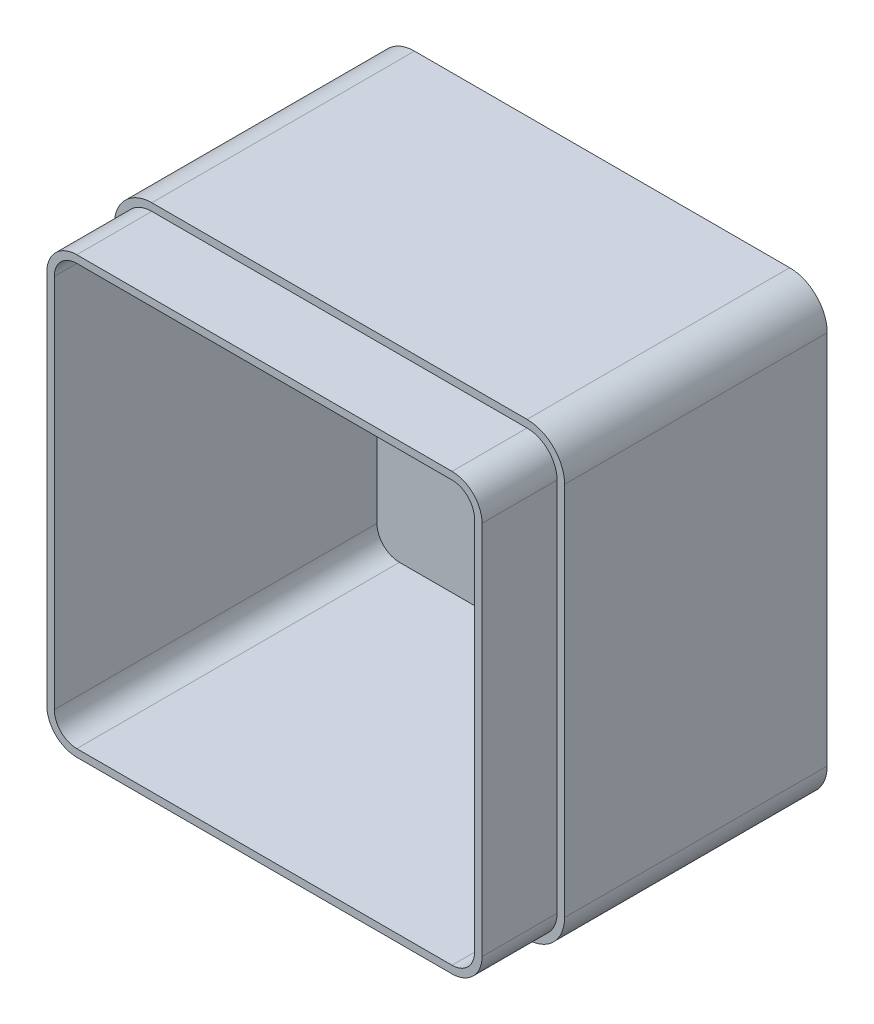
from build123d import *

# Parameters (mm, degrees)
SKETCH1_W           = 120
SKETCH1_H           = 120
BOSS_EXTRUDE1_DEPTH = 90
FILLET1_R           = 10
SHELL1_T            = -4
CUT_EXTRUDE1_DEPTH  = 20


with BuildPart() as part:
    # Sketch1 → Boss-Extrude1 (new body)
    with BuildSketch(Plane.XY):
        with Locations((60, 60)):
            Rectangle(SKETCH1_W, SKETCH1_H)
    extrude(amount=BOSS_EXTRUDE1_DEPTH)

    # Fillet1
    fillet1_edges = [part.edges().sort_by_distance(p)[0] for p in [
        (0, 120, 45),
        (120, 120, 45),
        (120, 0, 45),
        (0, 0, 45),
    ]]
    fillet(fillet1_edges, radius=FILLET1_R)

    # Shell1
    shell1_openings = [part.faces().sort_by_distance(p)[0] for p in [
        (60, 60, 90),
    ]]
    offset(amount=SHELL1_T, openings=shell1_openings, kind=Kind.INTERSECTION)

    # Sketch3 → Cut-Extrude1 (cut)
    with BuildSketch(Plane.XY.offset(90)):
        with BuildLine():
            Line((10, 0), (110, 0))
            ThreePointArc((110, 0), (117.071067812, 2.928932188), (120, 10))
            Line((120, 10), (120, 110))
            ThreePointArc((120, 110), (117.071067812, 117.071067812), (110, 120))
            Line((110, 120), (10, 120))
            ThreePointArc((10, 120), (2.928932188, 117.071067812), (0, 110))
            Line((0, 110), (0, 10))
            ThreePointArc((0, 10), (2.928932188, 2.928932188), (10, 0))
        make_face()
        with BuildLine():
            Line((10, 2), (110, 2))
            ThreePointArc((110, 2), (115.656854249, 4.343145751), (118, 10))
            Line((118, 10), (118, 110))
            ThreePointArc((118, 110), (115.656854249, 115.656854249), (110, 118))
            Line((110, 118), (10, 118))
            ThreePointArc((10, 118), (4.343145751, 115.656854249), (2, 110))
            Line((2, 110), (2, 10))
            ThreePointArc((2, 10), (4.343145751, 4.343145751), (10, 2))
        make_face(mode=Mode.SUBTRACT)
    extrude(amount=-CUT_EXTRUDE1_DEPTH, mode=Mode.SUBTRACT)


solid = part.part
